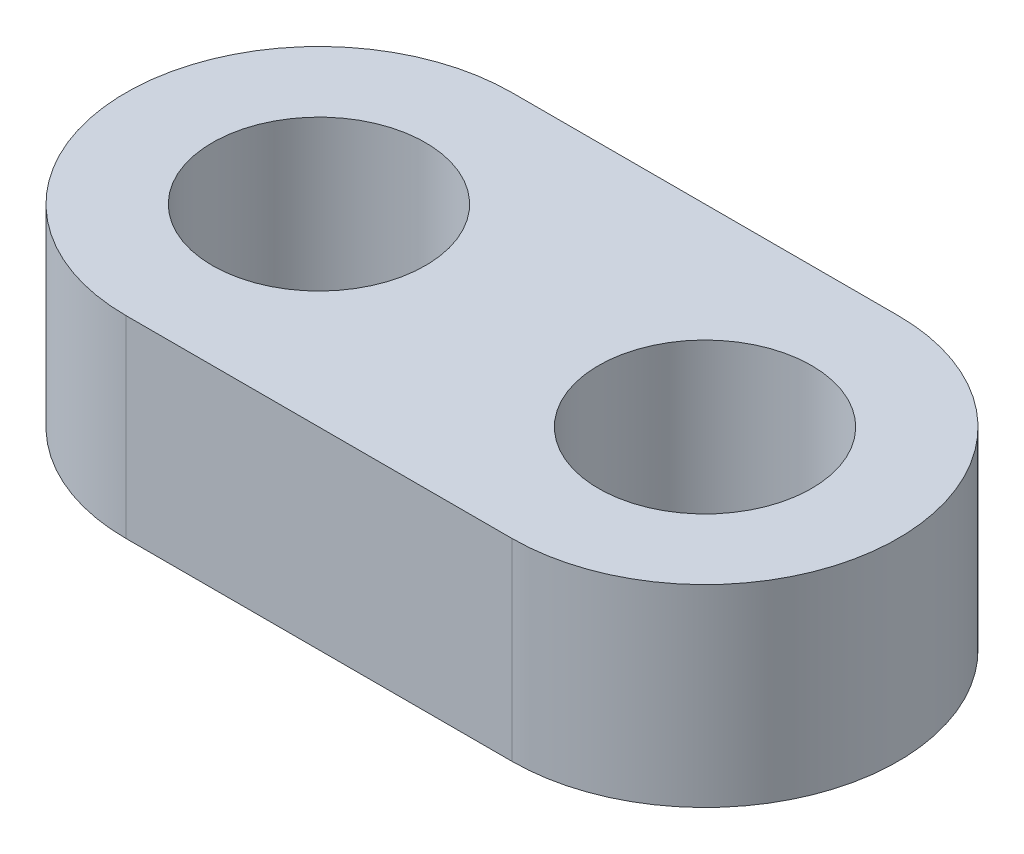
from build123d import *

# Parameters (mm, degrees)
SKETCH1_R           = 1.7526
BOSS_EXTRUDE1_DEPTH = 3.175


with BuildPart() as part:
    # Sketch1 → Boss-Extrude1 (new body)
    with BuildSketch(Plane(origin=(0, 0, 0), x_dir=(1, 0, 0), z_dir=(0, 1, 0))):
        with BuildLine():
            Line((-3.175, 3.175), (3.175, 3.175))
            ThreePointArc((3.175, 3.175), (6.35, 0), (3.175, -3.175))
            Line((3.175, -3.175), (-3.175, -3.175))
            ThreePointArc((-3.175, -3.175), (-6.35, 0), (-3.175, 3.175))
        make_face()
        with Locations(Location((-3.175, 0, 0), (0, 0, 270))):
            Circle(SKETCH1_R, mode=Mode.SUBTRACT)
        with Locations(Location((3.175, 0, 0), (0, 0, 90))):
            Circle(SKETCH1_R, mode=Mode.SUBTRACT)
    extrude(amount=BOSS_EXTRUDE1_DEPTH)


solid = part.part
